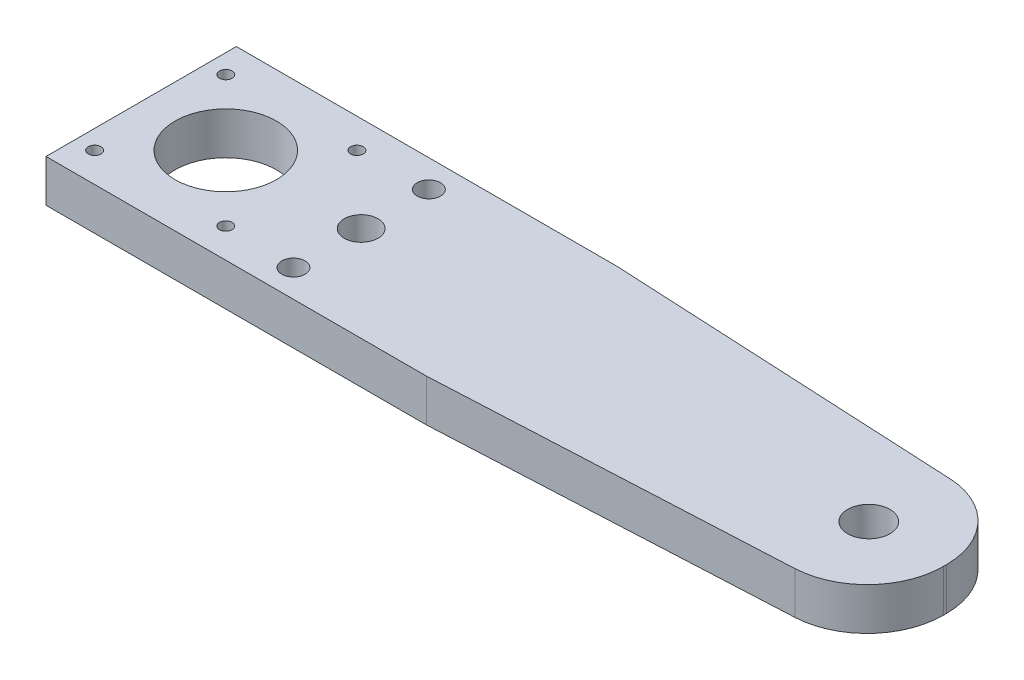
from build123d import *

# Parameters (mm, degrees)
SKETCH1_W           = 190
SKETCH1_H           = 45
BOSS_EXTRUDE1_DEPTH = 10
SKETCH2_R           = 1.5
SKETCH2_R_2         = 12
SKETCH2_R_3         = 4
SKETCH2_R_4         = 2.75
SKETCH2_R_5         = 5
CUT_EXTRUDE1_DEPTH  = 10
CUT_EXTRUDE2_DEPTH  = 10
FILLET1_R           = 18


with BuildPart() as part:
    # Sketch1 → Boss-Extrude1 (new body)
    with BuildSketch(Plane(origin=(0, 0, 0), x_dir=(1, 0, 0), z_dir=(0, 1, 0))):
        Rectangle(SKETCH1_W, SKETCH1_H)
    extrude(amount=BOSS_EXTRUDE1_DEPTH)

    # Sketch2 → Cut-Extrude1 (cut)
    with BuildSketch(Plane(origin=(0, 10, 0), x_dir=(1, 0, 0), z_dir=(0, 1, 0))):
        with Locations(Location((-90.5, 15.5, 0), (0, 0, 270))):
            Circle(SKETCH2_R)
        with Locations(Location((-59.5, 15.5, 0), (0, 0, 270))):
            Circle(SKETCH2_R)
        with Locations(Location((-90.5, -15.5, 0), (0, 0, 270))):
            Circle(SKETCH2_R)
        with Locations(Location((-59.5, -15.5, 0), (0, 0, 270))):
            Circle(SKETCH2_R)
        with Locations(Location((-75, 0, 0), (0, 0, 270))):
            Circle(SKETCH2_R_2)
        with Locations(Location((-43, 0, 0), (0, 0, 270))):
            Circle(SKETCH2_R_3)
        with Locations(Location((-43, 16, 0), (0, 0, 270))):
            Circle(SKETCH2_R_4)
        with Locations(Location((-43, -16, 0), (0, 0, 90))):
            Circle(SKETCH2_R_4)
        with Locations(Location((77, 0, 0), (0, 0, 270))):
            Circle(SKETCH2_R_5)
    extrude(amount=-CUT_EXTRUDE1_DEPTH, mode=Mode.SUBTRACT)

    # Sketch3 → Cut-Extrude2 (cut)
    with BuildSketch(Plane(origin=(0, 10, 0), x_dir=(1, 0, 0), z_dir=(0, 1, 0))):
        Polygon((95, -22.5), (-5, -22.5), (95, -17.5), align=None)
        Polygon((-5, 22.5), (95, 17.5), (95, 22.5), align=None)
    extrude(amount=-CUT_EXTRUDE2_DEPTH, mode=Mode.SUBTRACT)

    # Fillet1
    fillet1_edges = [part.edges().sort_by_distance(p)[0] for p in [
        (95, 5, 17.5),
        (95, 5, -17.5),
    ]]
    fillet(fillet1_edges, radius=FILLET1_R)


solid = part.part
